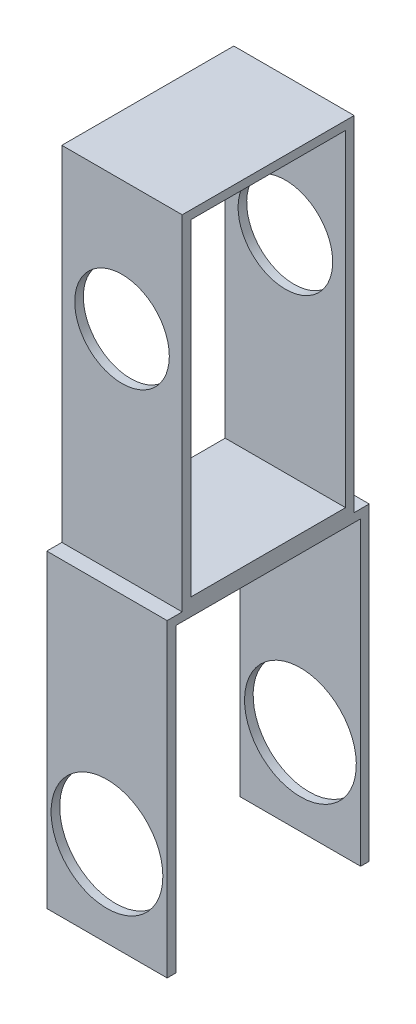
from build123d import *

# Parameters (mm, degrees)
SKETCH1_W           = 28
SKETCH1_H           = 80
SKETCH1_R           = 11
BOSS_EXTRUDE1_DEPTH = 40
SKETCH1_4_W         = 28
SKETCH1_4_H         = 72
SKETCH1_4_R         = 13
BOSS_EXTRUDE2_DEPTH = 43.5
BOSS_EXTRUDE3_START = -3.5
SKETCH1_5_W         = 28
SKETCH1_5_H         = 72
SKETCH1_5_R         = 13
BOSS_EXTRUDE3_DEPTH = 3.5
SKETCH3_W           = 36
SKETCH3_H           = 76
CUT_EXTRUDE1_DEPTH  = 28
SKETCH3_4_W         = 43
SKETCH3_4_H         = 70
CUT_EXTRUDE2_DEPTH  = 28


with BuildPart() as part:
    # Sketch1 → Boss-Extrude1 (new body)
    with BuildSketch(Plane.XY):
        with Locations((0, 36)):
            Rectangle(SKETCH1_W, SKETCH1_H)
        with Locations((0, 46)):
            Circle(SKETCH1_R, mode=Mode.SUBTRACT)
    extrude(amount=BOSS_EXTRUDE1_DEPTH)

    # Sketch1<4> → Boss-Extrude2 (add)
    with BuildSketch(Plane.XY):
        with Locations((0, -40)):
            Rectangle(SKETCH1_4_W, SKETCH1_4_H)
        with Locations((0, -56)):
            Circle(SKETCH1_4_R, mode=Mode.SUBTRACT)
    extrude(amount=BOSS_EXTRUDE2_DEPTH)

    # Sketch1<5> → Boss-Extrude3 (add)
    with BuildSketch(Plane.XY.offset(BOSS_EXTRUDE3_START)):
        with Locations((0, -40)):
            Rectangle(SKETCH1_5_W, SKETCH1_5_H)
        with Locations((0, -56)):
            Circle(SKETCH1_5_R, mode=Mode.SUBTRACT)
    extrude(amount=BOSS_EXTRUDE3_DEPTH)

    # Sketch3 → Cut-Extrude1 (cut)
    with BuildSketch(Plane(origin=(14, 0, 0), x_dir=(0, 0, -1), z_dir=(1, 0, 0))):
        with Locations((-20, 36)):
            Rectangle(SKETCH3_W, SKETCH3_H)
    extrude(amount=-CUT_EXTRUDE1_DEPTH, mode=Mode.SUBTRACT)

    # Sketch3<4> → Cut-Extrude2 (cut)
    with BuildSketch(Plane(origin=(14, 0, 0), x_dir=(0, 0, -1), z_dir=(1, 0, 0))):
        with Locations((-20, -41)):
            Rectangle(SKETCH3_4_W, SKETCH3_4_H)
    extrude(amount=-CUT_EXTRUDE2_DEPTH, mode=Mode.SUBTRACT)


solid = part.part
